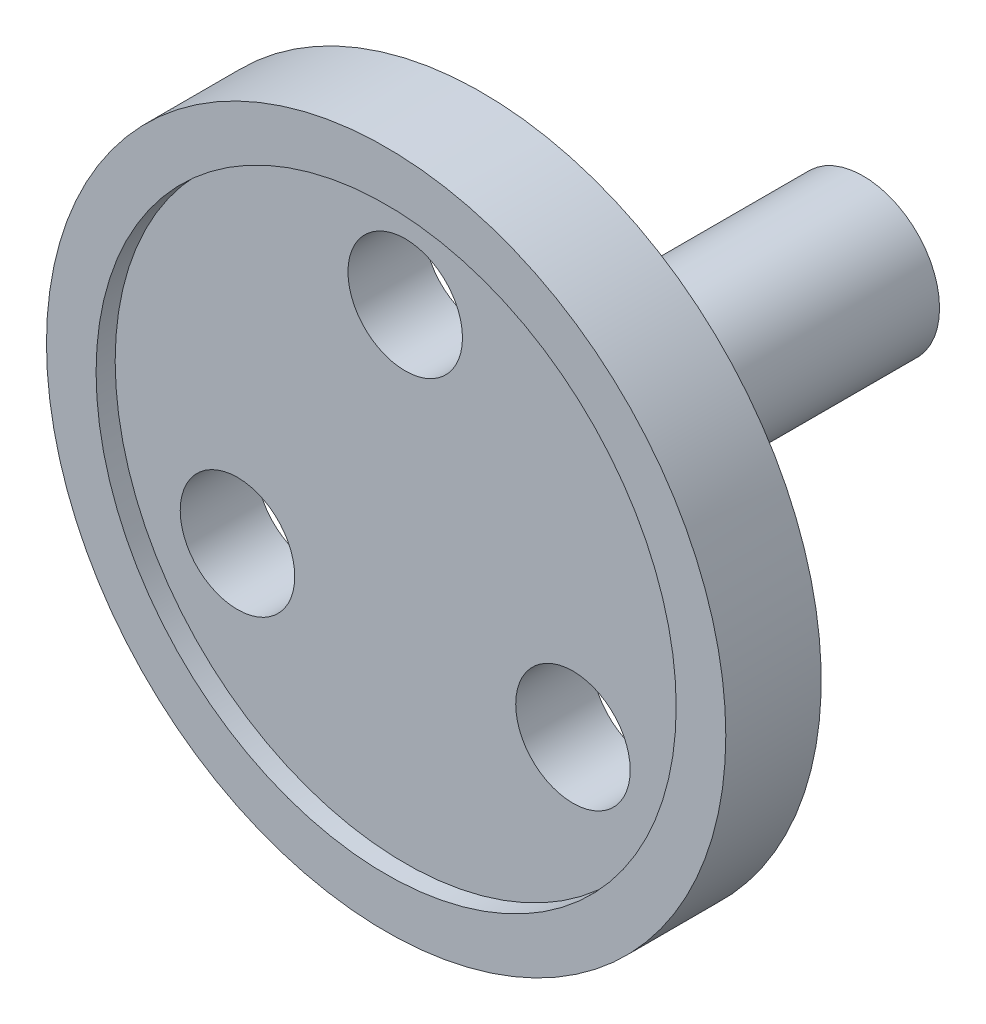
from build123d import *

# Parameters (mm, degrees)
SKETCH_1_R          = 8.9
SKETCH_1_R_2        = 1.5
EXTRUDE_1_DEPTH     = 3.5
SKETCH_2_R          = 7.6
CUT_EXTRUDE_1_DEPTH = 0.5
SKETCH_3_R          = 2
EXTRUDE_2_DEPTH     = 13
SKETCH_8_R          = 4
EXTRUDE_4_DEPTH     = 10
CUT_EXTRUDE_START   = -11.5
SKETCH_13_R         = 4
CUT_EXTRUDE_3_DEPTH = 11.5
SKETCH_16_R         = 8.9
SKETCH_16_R_2       = 2
CUT_EXTRUDE_5_DEPTH = 1
SKETCH_17_R         = 2
EXTRUDE_5_DEPTH     = 2


with BuildPart() as part:
    # 草图1 → 凸台-拉伸1 (new body)
    with BuildSketch(Plane.XY):
        Circle(SKETCH_1_R)
        with Locations((0, 5.075)):
            Circle(SKETCH_1_R_2, mode=Mode.SUBTRACT)
        with Locations((4.395078924, -2.5375)):
            Circle(SKETCH_1_R_2, mode=Mode.SUBTRACT)
        with Locations((-4.395078924, -2.5375)):
            Circle(SKETCH_1_R_2, mode=Mode.SUBTRACT)
    extrude(amount=EXTRUDE_1_DEPTH)

    # 草图2 → 切除-拉伸1 (cut)
    with BuildSketch(Plane.XY.offset(3.5)):
        Circle(SKETCH_2_R)
    extrude(amount=-CUT_EXTRUDE_1_DEPTH, mode=Mode.SUBTRACT)

    # 草图3 → 凸台-拉伸2 (add)
    with BuildSketch(Plane(origin=(0, 0, 0), x_dir=(-1, 0, 0), z_dir=(0, 0, -1))):
        with Locations(Location((0, 0, 0), (0, 0, 180))):
            Circle(SKETCH_3_R)
    extrude(amount=EXTRUDE_2_DEPTH)

    # 草图8 → 凸台-拉伸4 (add)
    with BuildSketch(Plane(origin=(0, 0, -8.5), x_dir=(-1, 0, 0), z_dir=(0, 0, -1))):
        Circle(SKETCH_8_R)
    extrude(amount=EXTRUDE_4_DEPTH)

    # 草图13 → 切除-拉伸3 (cut)
    with BuildSketch(Plane(origin=(0, 0, -18.5), x_dir=(-1, 0, 0), z_dir=(0, 0, -1)).offset(CUT_EXTRUDE_START)):
        Circle(SKETCH_13_R)
    extrude(amount=CUT_EXTRUDE_3_DEPTH, mode=Mode.SUBTRACT)

    # 草图16 → 切除-拉伸5 (cut)
    with BuildSketch(Plane(origin=(0, 0, 0), x_dir=(-1, 0, 0), z_dir=(0, 0, -1))):
        Circle(SKETCH_16_R)
        with Locations(Location((0, 0, 0), (0, 0, 180))):
            Circle(SKETCH_16_R_2, mode=Mode.SUBTRACT)
    extrude(amount=-CUT_EXTRUDE_5_DEPTH, mode=Mode.SUBTRACT)

    # 草图17 → 凸台-拉伸5 (add)
    with BuildSketch(Plane(origin=(0, 0, -7), x_dir=(-1, 0, 0), z_dir=(0, 0, -1))):
        with Locations(Location((0, 0, 0), (0, 0, 180))):
            Circle(SKETCH_17_R)
    extrude(amount=EXTRUDE_5_DEPTH)


solid = part.part
